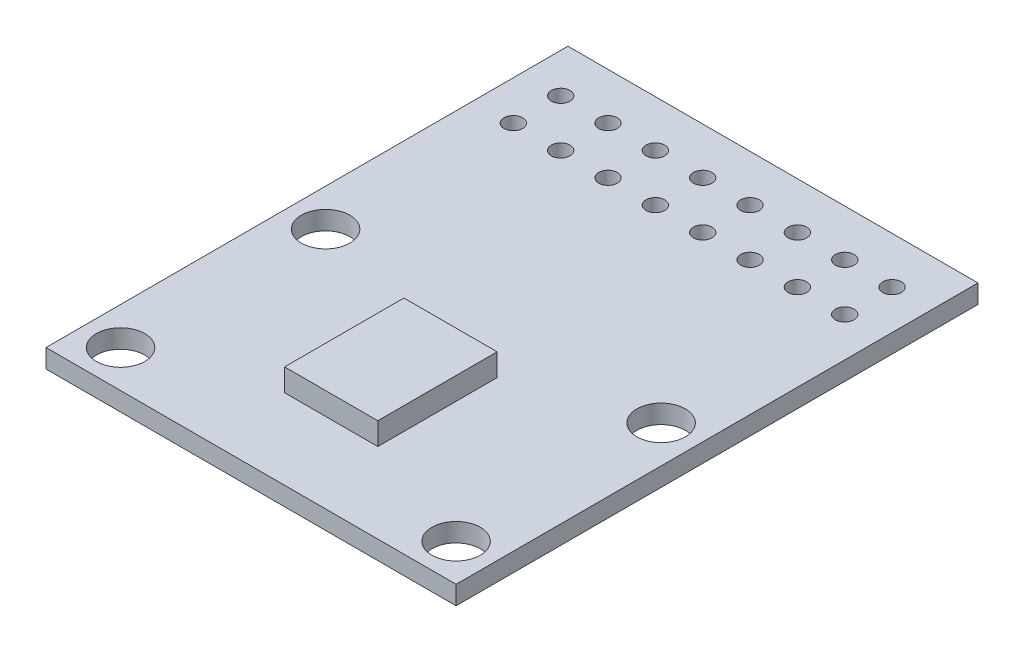
from build123d import *

# Parameters (mm, degrees)
SKETCH1_W           = 22
SKETCH1_H           = 28
BOSS_EXTRUDE1_DEPTH = 1
SKETCH2_R           = 1.3
CUT_EXTRUDE8_DEPTH  = 24.286262044
SKETCH3_W           = 5
SKETCH3_H           = 6.4
IC_DEPTH            = 1.2
SKETCH4_R           = 0.5
CUT_EXTRUDE9_DEPTH  = 24.368568634


with BuildPart() as part:
    # Sketch1 → Boss-Extrude1 (new body)
    with BuildSketch(Plane(origin=(0, 0, 0), x_dir=(1, 0, 0), z_dir=(0, 1, 0))):
        with Locations((0, 6.5)):
            Rectangle(SKETCH1_W, SKETCH1_H)
    extrude(amount=BOSS_EXTRUDE1_DEPTH)

    # Sketch2 → Cut-Extrude8 (cut, through all)
    with BuildSketch(Plane(origin=(0, 1, 0), x_dir=(1, 0, 0), z_dir=(0, 1, 0))):
        with Locations(Location((-9, -5.5, 0), (0, 0, 270))):
            Circle(SKETCH2_R)
        with Locations(Location((9, -5.5, 0), (0, 0, 270))):
            Circle(SKETCH2_R)
        with Locations(Location((9, 5.5, 0), (0, 0, 270))):
            Circle(SKETCH2_R)
        with Locations(Location((-9, 5.5, 0), (0, 0, 270))):
            Circle(SKETCH2_R)
    extrude(amount=-CUT_EXTRUDE8_DEPTH, mode=Mode.SUBTRACT)

    # Sketch3 → IC (add)
    with BuildSketch(Plane(origin=(0, 1, 0), x_dir=(1, 0, 0), z_dir=(0, 1, 0))):
        Rectangle(SKETCH3_W, SKETCH3_H)
    extrude(amount=IC_DEPTH)

    # Sketch4 → Cut-Extrude9 (cut, through all)
    with BuildSketch(Plane(origin=(0, 2.2, 0), x_dir=(1, 0, 0), z_dir=(0, 1, 0))):
        with Locations(Location((-8.89, 15.46, 0), (0, 0, 270))):
            Circle(SKETCH4_R)
        with Locations(Location((-6.35, 15.46, 0), (0, 0, 270))):
            Circle(SKETCH4_R)
        with Locations(Location((-3.81, 15.46, 0), (0, 0, 270))):
            Circle(SKETCH4_R)
        with Locations(Location((-1.27, 15.46, 0), (0, 0, 270))):
            Circle(SKETCH4_R)
        with Locations(Location((1.27, 15.46, 0), (0, 0, 270))):
            Circle(SKETCH4_R)
        with Locations(Location((3.81, 15.46, 0), (0, 0, 270))):
            Circle(SKETCH4_R)
        with Locations(Location((6.35, 15.46, 0), (0, 0, 270))):
            Circle(SKETCH4_R)
        with Locations(Location((8.89, 15.46, 0), (0, 0, 270))):
            Circle(SKETCH4_R)
        with Locations(Location((-6.35, 18, 0), (0, 0, 270))):
            Circle(SKETCH4_R)
        with Locations(Location((-3.81, 18, 0), (0, 0, 270))):
            Circle(SKETCH4_R)
        with Locations(Location((-1.27, 18, 0), (0, 0, 270))):
            Circle(SKETCH4_R)
        with Locations(Location((1.27, 18, 0), (0, 0, 270))):
            Circle(SKETCH4_R)
        with Locations(Location((3.81, 18, 0), (0, 0, 270))):
            Circle(SKETCH4_R)
        with Locations(Location((6.35, 18, 0), (0, 0, 270))):
            Circle(SKETCH4_R)
        with Locations(Location((8.89, 18, 0), (0, 0, 270))):
            Circle(SKETCH4_R)
        with Locations(Location((-8.89, 18, 0), (0, 0, 270))):
            Circle(SKETCH4_R)
    extrude(amount=-CUT_EXTRUDE9_DEPTH, mode=Mode.SUBTRACT)


solid = part.part
